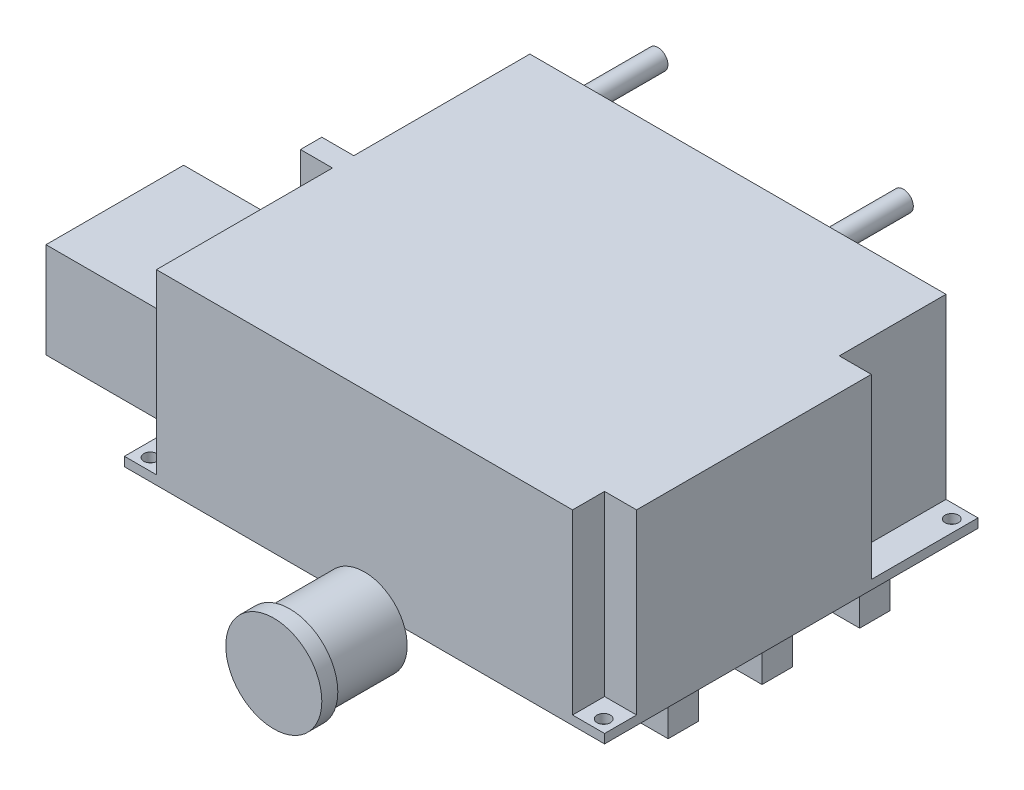
from build123d import *

# Parameters (mm, degrees)
SKETCH2_W               = 90
SKETCH2_H               = 70
BOSS_EXTRUDE1_DEPTH     = 35
SKETCH4_R               = 8
BOSS_EXTRUDE2_DEPTH     = 14
SKETCH6_W               = 6.6
SKETCH6_H               = 5.7
BOSS_EXTRUDE3_DEPTH     = 10
SKETCH10_W              = 6.6
SKETCH10_H              = 5.7
BOSS_EXTRUDE4_DEPTH     = 10
SKETCH7_W               = 6.6
SKETCH7_H               = 5.7
BOSS_EXTRUDE5_DEPTH     = 10
CUT_EXTRUDE1_DEPTH      = 123.786908504
CUT_EXTRUDE1_DEPTH_BACK = 123.786908504
SKETCH11_R              = 1.25
CUT_EXTRUDE2_DEPTH      = 123.786908504
CUT_EXTRUDE2_DEPTH_BACK = 123.786908504
SKETCH15_R              = 1.25
CUT_EXTRUDE3_DEPTH      = 123.786908504
CUT_EXTRUDE3_DEPTH_BACK = 123.786908504
SKETCH14_R              = 1.25
CUT_EXTRUDE4_DEPTH      = 123.786908504
CUT_EXTRUDE4_DEPTH_BACK = 123.786908504
SKETCH12_R              = 1.25
SKETCH16_W              = 6
SKETCH16_H              = 33
CUT_EXTRUDE5_DEPTH      = 33.3
SKETCH19_W              = 6
SKETCH19_H              = 33
CUT_EXTRUDE6_DEPTH      = 33.3
SKETCH18_W              = 6
SKETCH18_H              = 6
CUT_EXTRUDE7_DEPTH      = 33.3
SKETCH17_W              = 6
SKETCH17_H              = 20
CUT_EXTRUDE8_DEPTH      = 33.3
SKETCH20_W              = 25.8
SKETCH20_H              = 17.9
BOSS_EXTRUDE6_DEPTH     = 39.4
SKETCH27_R              = 9
BOSS_EXTRUDE7_DEPTH     = 3
SKETCH29_W              = 2.1
SKETCH29_H              = 25.8
CUT_EXTRUDE14_DEPTH     = 2.5
SKETCH34_W              = 2.1
SKETCH34_H              = 15.4
CUT_EXTRUDE15_DEPTH     = 2.5
SKETCH35_W              = 2.1
SKETCH35_H              = 23.3
CUT_EXTRUDE16_DEPTH     = 2.5
SKETCH36_W              = 2.1
SKETCH36_H              = 12.9
CUT_EXTRUDE17_DEPTH     = 2.5
SKETCH38_R              = 1.875
BOSS_EXTRUDE8_DEPTH     = 20


with BuildPart() as part:
    # Sketch2 → Boss-Extrude1 (new body)
    with BuildSketch(Plane(origin=(0, 0, 0), x_dir=(1, 0, 0), z_dir=(0, 1, 0))):
        with Locations((45, 35)):
            Rectangle(SKETCH2_W, SKETCH2_H)
    extrude(amount=BOSS_EXTRUDE1_DEPTH)

    # Sketch4 → Boss-Extrude2 (add)
    with BuildSketch(Plane.XY):
        with Locations(Location((45, -2.57, 0), (0, 0, 161.261463564))):
            Circle(SKETCH4_R)
    extrude(amount=BOSS_EXTRUDE2_DEPTH)

    # Sketch6 → Boss-Extrude3 (add)
    with BuildSketch(Plane(origin=(0, 0, 0), x_dir=(-1, 0, 0), z_dir=(0, -1, 0))):
        with Locations((-81.82, 55.55)):
            Rectangle(SKETCH6_W, SKETCH6_H)
    extrude(amount=BOSS_EXTRUDE3_DEPTH)

    # Sketch10 → Boss-Extrude4 (add)
    with BuildSketch(Plane.XZ):
        with Locations((81.82, -37.25)):
            Rectangle(SKETCH10_W, SKETCH10_H)
    extrude(amount=BOSS_EXTRUDE4_DEPTH)

    # Sketch7 → Boss-Extrude5 (add)
    with BuildSketch(Plane.XZ):
        with Locations((81.82, -19.65)):
            Rectangle(SKETCH7_W, SKETCH7_H)
    extrude(amount=BOSS_EXTRUDE5_DEPTH)

    # Sketch11 → Cut-Extrude1 (cut, two sides: drawn at the far end of the back side and taken through both)
    with BuildSketch(Plane(origin=(0, 35, 0), x_dir=(1, 0, 0), z_dir=(0, 1, 0)).offset(-CUT_EXTRUDE1_DEPTH_BACK)):
        with Locations(Location((87.55, 2.29, 0), (0, 0, 90))):
            Circle(SKETCH11_R)
    extrude(amount=CUT_EXTRUDE1_DEPTH + CUT_EXTRUDE1_DEPTH_BACK, mode=Mode.SUBTRACT)

    # Sketch15 → Cut-Extrude2 (cut, two sides: drawn at the far end of the back side and taken through both)
    with BuildSketch(Plane(origin=(0, 35, 0), x_dir=(1, 0, 0), z_dir=(0, 1, 0)).offset(-CUT_EXTRUDE2_DEPTH_BACK)):
        with Locations(Location((2.61, 67.35, 0), (0, 0, 90))):
            Circle(SKETCH15_R)
    extrude(amount=CUT_EXTRUDE2_DEPTH + CUT_EXTRUDE2_DEPTH_BACK, mode=Mode.SUBTRACT)

    # Sketch14 → Cut-Extrude3 (cut, two sides: drawn at the far end of the back side and taken through both)
    with BuildSketch(Plane(origin=(0, 35, 0), x_dir=(1, 0, 0), z_dir=(0, 1, 0)).offset(-CUT_EXTRUDE3_DEPTH_BACK)):
        with Locations(Location((2.63, 2.25, 0), (0, 0, 90))):
            Circle(SKETCH14_R)
    extrude(amount=CUT_EXTRUDE3_DEPTH + CUT_EXTRUDE3_DEPTH_BACK, mode=Mode.SUBTRACT)

    # Sketch12 → Cut-Extrude4 (cut, two sides: drawn at the far end of the back side and taken through both)
    with BuildSketch(Plane(origin=(0, 35, 0), x_dir=(1, 0, 0), z_dir=(0, 1, 0)).offset(-CUT_EXTRUDE4_DEPTH_BACK)):
        with Locations(Location((87.71, 67.37, 0), (0, 0, 90))):
            Circle(SKETCH12_R)
    extrude(amount=CUT_EXTRUDE4_DEPTH + CUT_EXTRUDE4_DEPTH_BACK, mode=Mode.SUBTRACT)

    # Sketch16 → Cut-Extrude5 (cut)
    with BuildSketch(Plane(origin=(0, 35, 0), x_dir=(1, 0, 0), z_dir=(0, 1, 0))):
        with Locations((3, 53.5)):
            Rectangle(SKETCH16_W, SKETCH16_H)
    extrude(amount=-CUT_EXTRUDE5_DEPTH, mode=Mode.SUBTRACT)

    # Sketch19 → Cut-Extrude6 (cut)
    with BuildSketch(Plane(origin=(0, 35, 0), x_dir=(1, 0, 0), z_dir=(0, 1, 0))):
        with Locations((3, 16.5)):
            Rectangle(SKETCH19_W, SKETCH19_H)
    extrude(amount=-CUT_EXTRUDE6_DEPTH, mode=Mode.SUBTRACT)

    # Sketch18 → Cut-Extrude7 (cut)
    with BuildSketch(Plane(origin=(0, 35, 0), x_dir=(1, 0, 0), z_dir=(0, 1, 0))):
        with Locations((87, 3)):
            Rectangle(SKETCH18_W, SKETCH18_H)
    extrude(amount=-CUT_EXTRUDE7_DEPTH, mode=Mode.SUBTRACT)

    # Sketch17 → Cut-Extrude8 (cut)
    with BuildSketch(Plane(origin=(0, 35, 0), x_dir=(1, 0, 0), z_dir=(0, 1, 0))):
        with Locations((87, 60)):
            Rectangle(SKETCH17_W, SKETCH17_H)
    extrude(amount=-CUT_EXTRUDE8_DEPTH, mode=Mode.SUBTRACT)

    # Sketch20 → Boss-Extrude6 (add)
    with BuildSketch(Plane(origin=(0, 0, 0), x_dir=(0, 0, -1), z_dir=(1, 0, 0))):
        with Locations((37.6, -4.95)):
            Rectangle(SKETCH20_W, SKETCH20_H)
    extrude(amount=-BOSS_EXTRUDE6_DEPTH)

    # Sketch27 → Boss-Extrude7 (add)
    with BuildSketch(Plane.XY.offset(14)):
        with Locations((45, -2.57)):
            Circle(SKETCH27_R)
    extrude(amount=BOSS_EXTRUDE7_DEPTH)

    # Sketch29 → Cut-Extrude14 (cut)
    with BuildSketch(Plane(origin=(0, 4, 0), x_dir=(1, 0, 0), z_dir=(0, 1, 0))):
        with Locations((-13.05, 37.6)):
            Rectangle(SKETCH29_W, SKETCH29_H)
    extrude(amount=-CUT_EXTRUDE14_DEPTH, mode=Mode.SUBTRACT)

    # Sketch34 → Cut-Extrude15 (cut)
    with BuildSketch(Plane.XY.offset(-24.7)):
        with Locations((-13.05, -6.2)):
            Rectangle(SKETCH34_W, SKETCH34_H)
    extrude(amount=-CUT_EXTRUDE15_DEPTH, mode=Mode.SUBTRACT)

    # Sketch35 → Cut-Extrude16 (cut)
    with BuildSketch(Plane.XZ.offset(13.9)):
        with Locations((-13.05, -38.85)):
            Rectangle(SKETCH35_W, SKETCH35_H)
    extrude(amount=-CUT_EXTRUDE16_DEPTH, mode=Mode.SUBTRACT)

    # Sketch36 → Cut-Extrude17 (cut)
    with BuildSketch(Plane(origin=(0, 0, -50.5), x_dir=(-1, 0, 0), z_dir=(0, 0, -1))):
        with Locations((13.05, -4.95)):
            Rectangle(SKETCH36_W, SKETCH36_H)
    extrude(amount=-CUT_EXTRUDE17_DEPTH, mode=Mode.SUBTRACT)

    # Sketch38 → Boss-Extrude8 (add)
    with BuildSketch(Plane(origin=(0, 0, -70), x_dir=(-1, 0, 0), z_dir=(0, 0, -1))):
        with Locations(Location((-56, 26.2, 0), (0, 0, 180))):
            Circle(SKETCH38_R)
        with Locations(Location((-10, 26.2, 0), (0, 0, 180))):
            Circle(SKETCH38_R)
    extrude(amount=BOSS_EXTRUDE8_DEPTH)


solid = part.part
